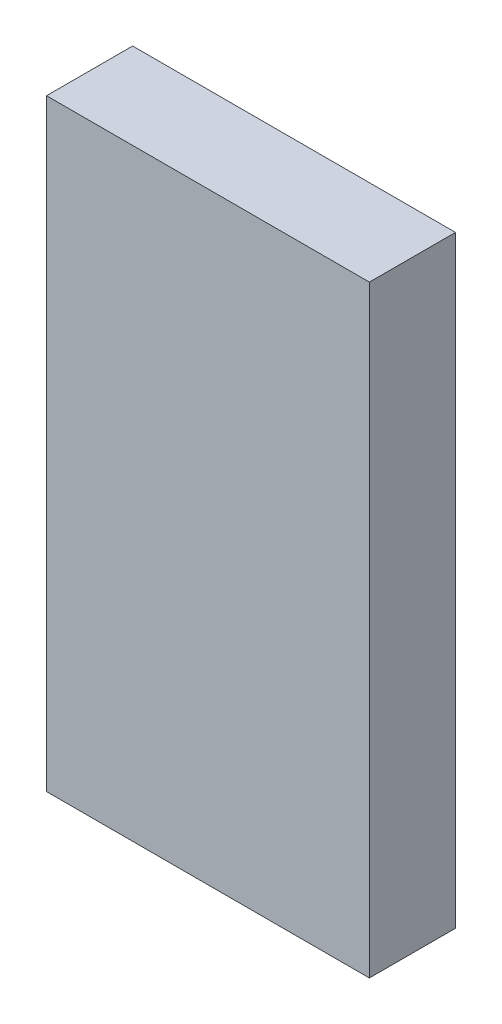
from build123d import *

# Parameters (mm, degrees)
BOSS_EXTRUDE1_DEPTH = 40


with BuildPart() as part:
    # 3DSketch1 → Boss-Extrude1 (new body)
    with BuildSketch(Plane(origin=(433.013135805, 1132.387606431, 249.224010025), x_dir=(-0.4722214125154189, -0.8814799700287822, 0), z_dir=(0, 0, -1))):
        Polygon((0, 0), (70.833211877, 132.221995504), (317.647603485, 0), (246.814391608, -132.221995504), align=None)
    extrude(amount=BOSS_EXTRUDE1_DEPTH)


solid = part.part
